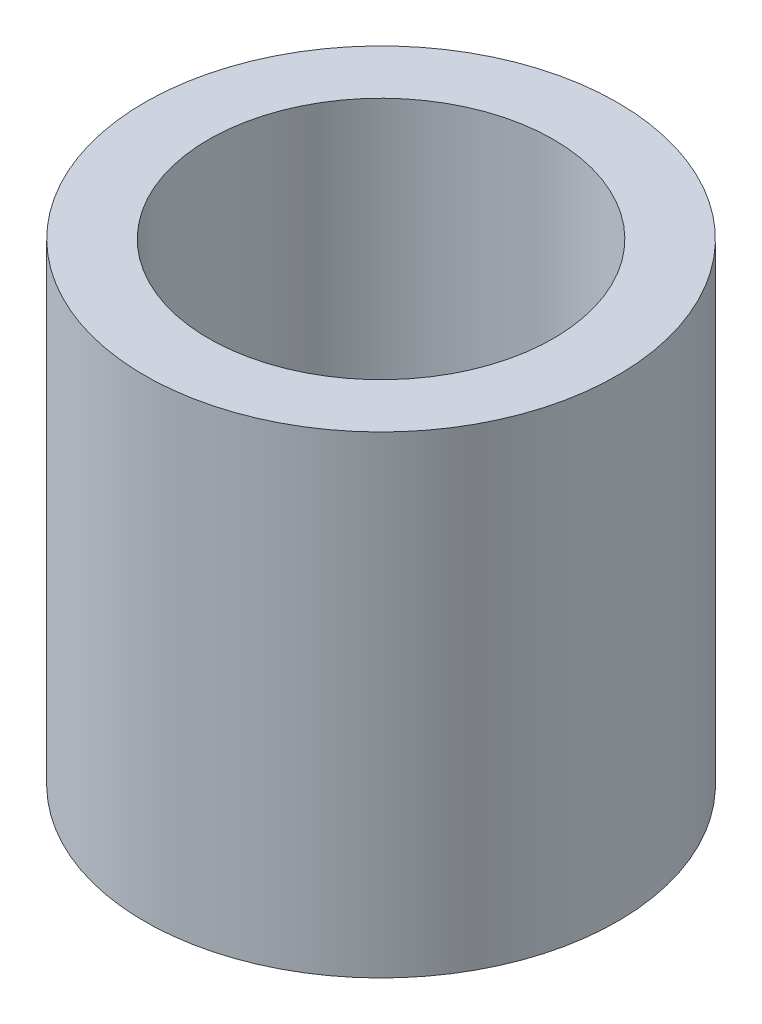
from build123d import *

# Parameters (mm, degrees)
SKETCH1_W = 0.3302
SKETCH1_H = 2.4384


with BuildPart() as part:
    # Sketch1 → Revolve1 (revolve)
    with BuildSketch(Plane.XY, mode=Mode.PRIVATE) as revolve1_sk:
        with Locations((1.0541, 1.2192)):
            Rectangle(SKETCH1_W, SKETCH1_H)
    revolve(revolve1_sk.sketch.rotate(Axis((0, 0, 0), (0, 1, 0)), 90), axis=Axis((0, 0, 0), (0, 1, 0)))


solid = part.part
